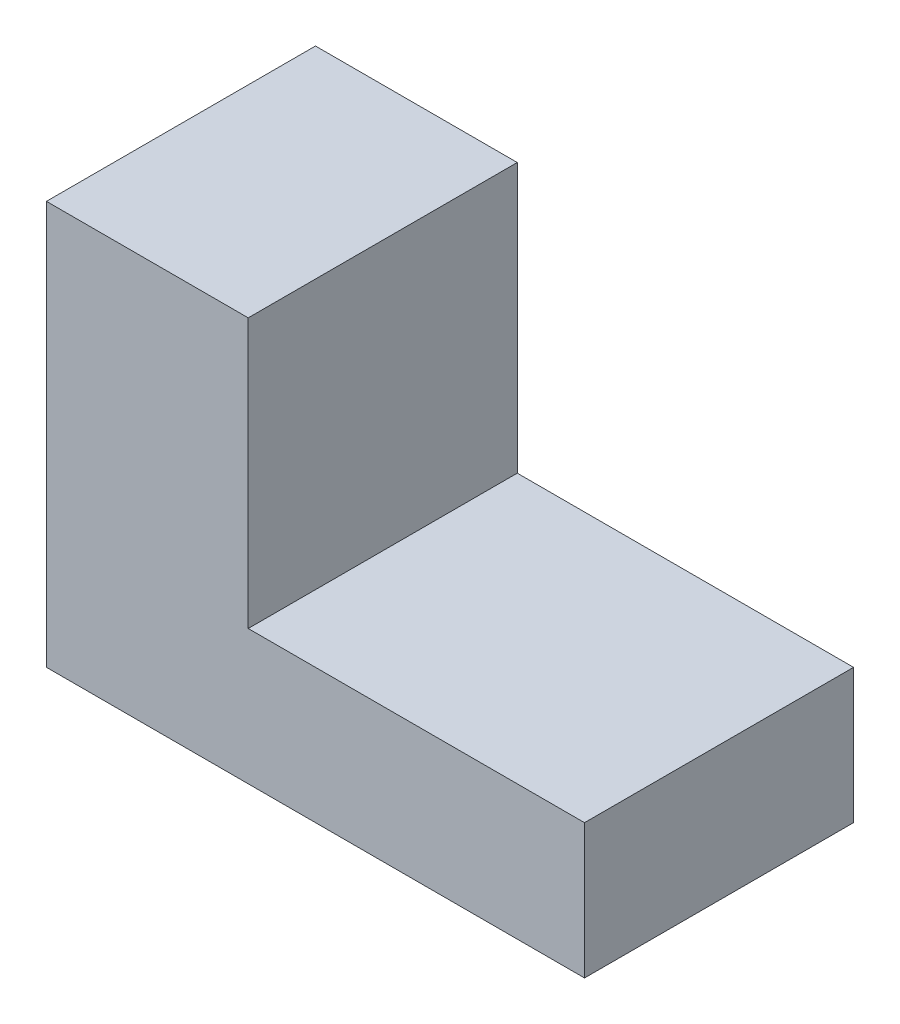
from build123d import *

# Parameters (mm, degrees)
FEATURE_BASE_DEPTH = 20


with BuildPart() as part:
    # sketch:main-profile → feature:base (new body)
    with BuildSketch(Plane.XY):
        Polygon((0, 0), (40, 0), (40, 10), (15, 10), (15, 30), (0, 30), align=None)
    extrude(amount=FEATURE_BASE_DEPTH)


solid = part.part
